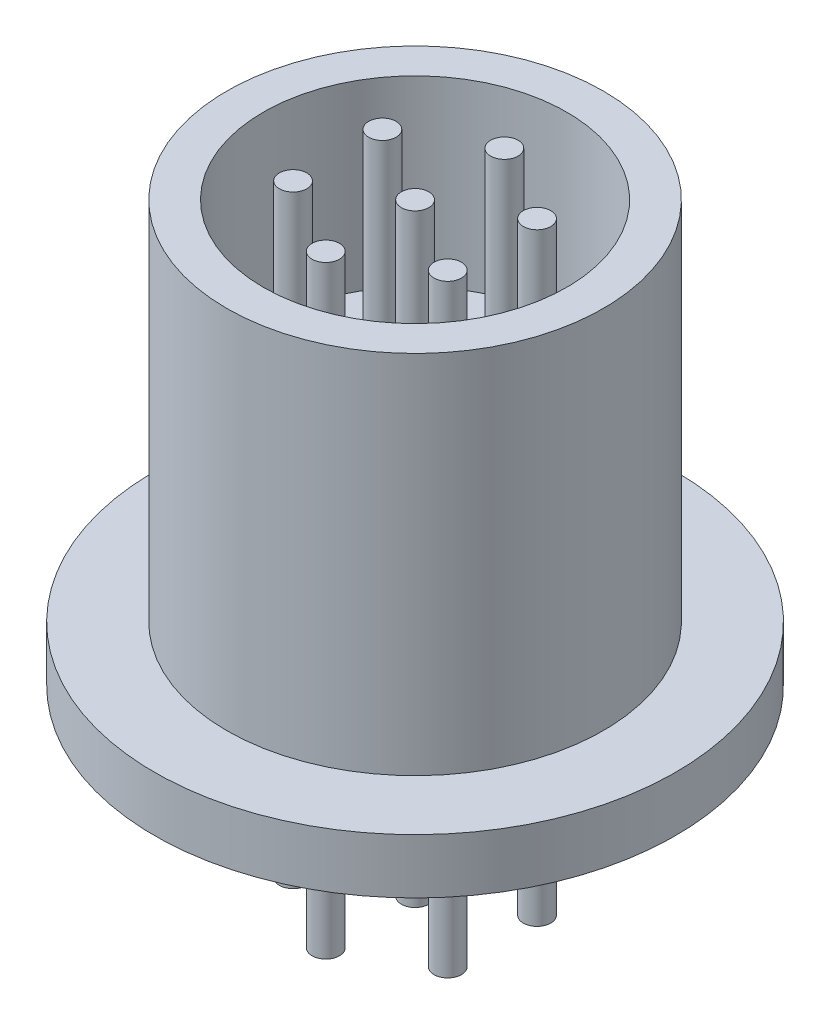
from build123d import *

# Parameters (mm, degrees)
SKETCH1_R           = 10.3
BOSS_EXTRUDE1_DEPTH = 20
SKETCH2_R           = 14.25
BOSS_EXTRUDE2_DEPTH = 3
SKETCH3_R           = 8.3
CUT_EXTRUDE1_DEPTH  = 10
SKETCH4_R           = 0.75
BOSS_EXTRUDE3_DEPTH = 10
BOSS_EXTRUDE4_START = 10
SKETCH5_R           = 0.75
BOSS_EXTRUDE4_DEPTH = 10


with BuildPart() as part:
    # Sketch1 → Boss-Extrude1 (new body)
    with BuildSketch(Plane(origin=(0, 0, 0), x_dir=(1, 0, 0), z_dir=(0, 1, 0))):
        with Locations(Location((0, 0, 0), (0, 0, 270))):
            Circle(SKETCH1_R)
    extrude(amount=BOSS_EXTRUDE1_DEPTH)

    # Sketch2 → Boss-Extrude2 (add)
    with BuildSketch(Plane.XZ):
        with Locations(Location((0, 0, 0), (0, 0, 270))):
            Circle(SKETCH2_R)
    extrude(amount=BOSS_EXTRUDE2_DEPTH)

    # Sketch3 → Cut-Extrude1 (cut)
    with BuildSketch(Plane(origin=(0, 20, 0), x_dir=(1, 0, 0), z_dir=(0, 1, 0))):
        with Locations(Location((0, 0, 0), (0, 0, 270))):
            Circle(SKETCH3_R)
    extrude(amount=-CUT_EXTRUDE1_DEPTH, mode=Mode.SUBTRACT)

    # Sketch4 → Boss-Extrude3 (add)
    with BuildSketch(Plane(origin=(0, 10, 0), x_dir=(1, 0, 0), z_dir=(0, 1, 0))):
        with Locations(Location((0, 4.884385532, 0), (0, 0, 270))):
            Circle(SKETCH4_R)
        with Locations(Location((4.230001953, 2.442192766, 0), (0, 0, 270))):
            Circle(SKETCH4_R)
        with Locations(Location((4.230001953, -2.442192766, 0), (0, 0, 270))):
            Circle(SKETCH4_R)
        with Locations(Location((0, -4.884385532, 0), (0, 0, 270))):
            Circle(SKETCH4_R)
        with Locations(Location((-4.230001953, -2.442192766, 0), (0, 0, 270))):
            Circle(SKETCH4_R)
        with Locations(Location((-4.230001953, 2.442192766, 0), (0, 0, 270))):
            Circle(SKETCH4_R)
        with Locations(Location((0, 0, 0), (0, 0, 270))):
            Circle(SKETCH4_R)
    extrude(amount=BOSS_EXTRUDE3_DEPTH)

    # Sketch5 → Boss-Extrude4 (add)
    with BuildSketch(Plane.XZ.offset(3).offset(BOSS_EXTRUDE4_START)):
        with Locations(Location((0, 0, 0), (0, 0, 90))):
            Circle(SKETCH5_R)
        with Locations(Location((-4.230001953, -2.442192766, 0), (0, 0, 90))):
            Circle(SKETCH5_R)
        with Locations(Location((-4.230001953, 2.442192766, 0), (0, 0, 90))):
            Circle(SKETCH5_R)
        with Locations(Location((0, 4.884385532, 0), (0, 0, 90))):
            Circle(SKETCH5_R)
        with Locations(Location((4.230001953, 2.442192766, 0), (0, 0, 90))):
            Circle(SKETCH5_R)
        with Locations(Location((4.230001953, -2.442192766, 0), (0, 0, 90))):
            Circle(SKETCH5_R)
        with Locations(Location((0, -4.884385532, 0), (0, 0, 90))):
            Circle(SKETCH5_R)
    extrude(amount=-BOSS_EXTRUDE4_DEPTH)


solid = part.part
